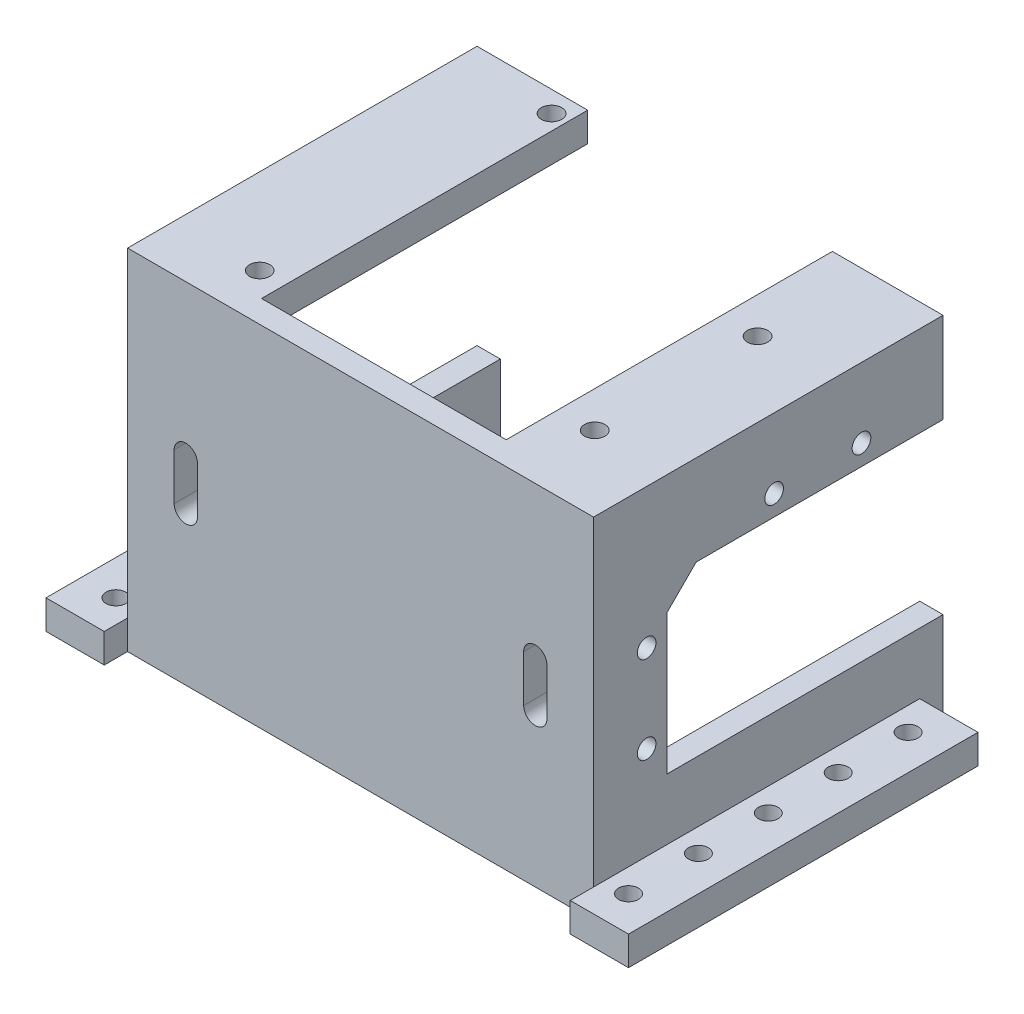
from build123d import *

# Parameters (mm, degrees)
SKETCH_1_W           = 80
SKETCH_1_H           = 60
EXTRUDE_1_DEPTH      = 30
SKETCH_2_W           = 72
SKETCH_2_H           = 56
CUT_EXTRUDE_1_DEPTH  = 70
SKETCH_3_W           = 47.385697094
SKETCH_3_H           = 29
CUT_EXTRUDE_2_DEPTH  = 80
SKETCH_4_W           = 10
SKETCH_4_H           = 60
EXTRUDE_2_DEPTH      = 5
SKETCH_5_R           = 1.7
CUT_EXTRUDE_3_DEPTH  = 25
SKETCH_6_W           = 15
SKETCH_6_H           = 56
EXTRUDE_3_DEPTH      = 5
SKETCH_8_R           = 1.75
CUT_EXTRUDE_5_DEPTH  = 10
CHAMFER_1_SIZE       = 5
CUT_EXTRUDE_8_DEPTH  = 10
SKETCH_11_R          = 1.6
CUT_EXTRUDE_9_DEPTH  = 100
SKETCH_12_R          = 1.6
CUT_EXTRUDE_10_DEPTH = 120


with BuildPart() as part:
    # 草图1 → 凸台-拉伸1 (new, symmetric)
    with BuildSketch(Plane(origin=(0, 0, 0), x_dir=(1, 0, 0), z_dir=(0, 1, 0))):
        Rectangle(SKETCH_1_W, SKETCH_1_H)
    extrude(amount=EXTRUDE_1_DEPTH, both=True)

    # 草图2 → 切除-拉伸1 (cut)
    with BuildSketch(Plane(origin=(0, 30, 0), x_dir=(1, 0, 0), z_dir=(0, 1, 0))):
        with Locations((0, 2)):
            Rectangle(SKETCH_2_W, SKETCH_2_H)
    extrude(amount=-CUT_EXTRUDE_1_DEPTH, mode=Mode.SUBTRACT)

    # 草图3 → 切除-拉伸2 (cut)
    with BuildSketch(Plane(origin=(40, 0, 0), x_dir=(0, 0, -1), z_dir=(1, 0, 0))):
        with Locations((6.307151453, 0)):
            Rectangle(SKETCH_3_W, SKETCH_3_H)
    extrude(amount=-CUT_EXTRUDE_2_DEPTH, mode=Mode.SUBTRACT)

    # 草图4 → 凸台-拉伸2 (add)
    with BuildSketch(Plane.XZ.offset(30)):
        with Locations((-45, 4)):
            Rectangle(SKETCH_4_W, SKETCH_4_H)
        with Locations((45, 4)):
            Rectangle(SKETCH_4_W, SKETCH_4_H)
    extrude(amount=-EXTRUDE_2_DEPTH)

    # 草图5 → 切除-拉伸3 (cut)
    with BuildSketch(Plane(origin=(0, -25, 0), x_dir=(1, 0, 0), z_dir=(0, 1, 0))):
        with Locations(Location((-44, 20, 0), (0, 0, 270))):
            Circle(SKETCH_5_R)
        with Locations(Location((-44, 8, 0), (0, 0, 270))):
            Circle(SKETCH_5_R)
        with Locations(Location((-44, -4, 0), (0, 0, 270))):
            Circle(SKETCH_5_R)
        with Locations(Location((-44, -16, 0), (0, 0, 270))):
            Circle(SKETCH_5_R)
        with Locations(Location((-44, -28, 0), (0, 0, 270))):
            Circle(SKETCH_5_R)
        with Locations(Location((44, -28, 0), (0, 0, 90))):
            Circle(SKETCH_5_R)
        with Locations(Location((44, -16, 0), (0, 0, 90))):
            Circle(SKETCH_5_R)
        with Locations(Location((44, -4, 0), (0, 0, 90))):
            Circle(SKETCH_5_R)
        with Locations(Location((44, 8, 0), (0, 0, 90))):
            Circle(SKETCH_5_R)
        with Locations(Location((44, 20, 0), (0, 0, 90))):
            Circle(SKETCH_5_R)
    extrude(amount=-CUT_EXTRUDE_3_DEPTH, mode=Mode.SUBTRACT)

    # 草图6 → 凸台-拉伸3 (add)
    with BuildSketch(Plane(origin=(0, 30, 0), x_dir=(1, 0, 0), z_dir=(0, 1, 0))):
        with Locations((-28.5, 2)):
            Rectangle(SKETCH_6_W, SKETCH_6_H)
        with Locations((28.5, 2)):
            Rectangle(SKETCH_6_W, SKETCH_6_H)
    extrude(amount=-EXTRUDE_3_DEPTH)

    # 草图8 → 切除-拉伸5 (cut)
    with BuildSketch(Plane(origin=(0, 30, 0), x_dir=(1, 0, 0), z_dir=(0, 1, 0))):
        with Locations(Location((-25.32, -22, 0), (0, 0, 270))):
            Circle(SKETCH_8_R)
        with Locations(Location((-23.61, 26.395, 0), (0, 0, 270))):
            Circle(SKETCH_8_R)
        with Locations(Location((27.2, 10.96, 0), (0, 0, 270))):
            Circle(SKETCH_8_R)
        with Locations(Location((27.2, -17, 0), (0, 0, 270))):
            Circle(SKETCH_8_R)
    extrude(amount=-CUT_EXTRUDE_5_DEPTH, mode=Mode.SUBTRACT)

    # 倒角1
    chamfer_1_edges = [part.edges().sort_by_distance(p)[0] for p in [
        (38, 14.5, 17.385697094),
        (-38, 14.5, 17.385697094),
    ]]
    chamfer(chamfer_1_edges, length=CHAMFER_1_SIZE)

    # 草图10 → 切除-拉伸8 (cut)
    with BuildSketch(Plane.XY.offset(30)):
        with BuildLine():
            Line((-28, 4), (-28, -4))
            ThreePointArc((-28, -4), (-30, -6), (-32, -4))
            Line((-32, -4), (-32, 4))
            ThreePointArc((-32, 4), (-30, 6), (-28, 4))
        make_face()
        with BuildLine():
            Line((28, 4), (28, -4))
            ThreePointArc((28, -4), (30, -6), (32, -4))
            Line((32, -4), (32, 4))
            ThreePointArc((32, 4), (30, 6), (28, 4))
        make_face()
    extrude(amount=-CUT_EXTRUDE_8_DEPTH, mode=Mode.SUBTRACT)

    # 草图11 → 切除-拉伸9 (cut)
    with BuildSketch(Plane.ZY.offset(40)):
        with Locations((-16, 18)):
            Circle(SKETCH_11_R)
        with Locations((-1, 18)):
            Circle(SKETCH_11_R)
    extrude(amount=-CUT_EXTRUDE_9_DEPTH, mode=Mode.SUBTRACT)

    # 草图12 → 切除-拉伸10 (cut)
    with BuildSketch(Plane.ZY.offset(40)):
        with Locations((20.885697094, 6)):
            Circle(SKETCH_12_R)
        with Locations((20.885697094, -9)):
            Circle(SKETCH_12_R)
    extrude(amount=-CUT_EXTRUDE_10_DEPTH, mode=Mode.SUBTRACT)


solid = part.part
